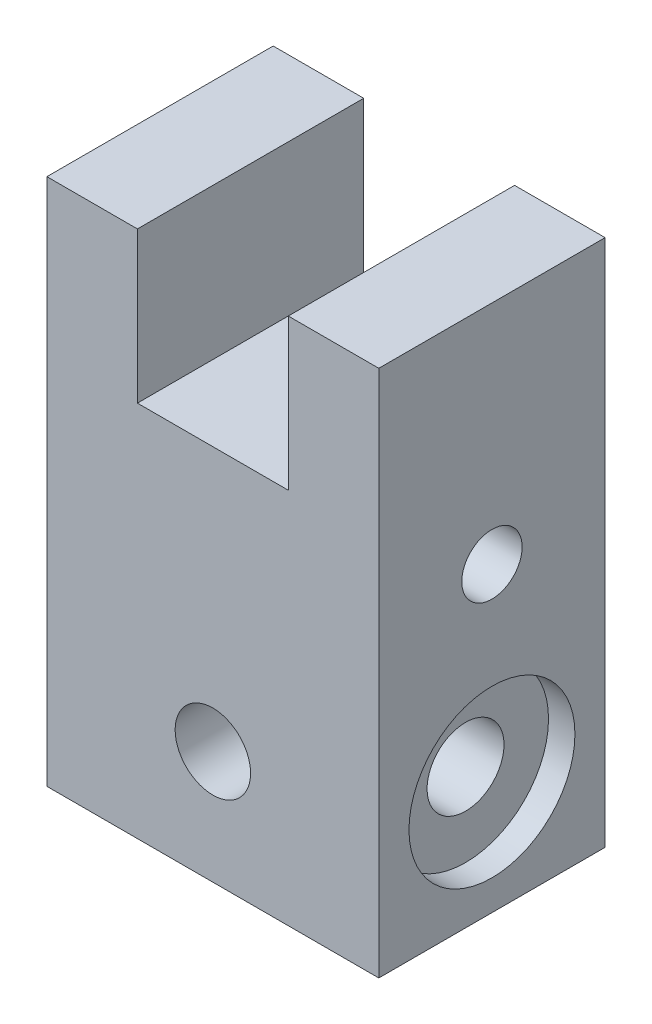
from build123d import *

# Parameters (mm, degrees)
CROQUIS1_R              = 5
SALIENTE_EXTRUIR1_DEPTH = 30
CROQUIS2_R              = 11
CORTAR_EXTRUIR1_DEPTH   = 3.5
CROQUIS3_R              = 5.1
CORTAR_EXTRUIR2_DEPTH   = 62.361632964
CROQUIS4_R              = 4
CORTAR_EXTRUIR3_DEPTH   = 64.725975982


with BuildPart() as part:
    # Croquis1 → Saliente-Extruir1 (new body)
    with BuildSketch(Plane.XY):
        Polygon((-10, 35), (-22, 35), (-22, -35), (22, -35), (22, 35), (10, 35), (10, 15), (-10, 15), align=None)
        with Locations((0, -20)):
            Circle(CROQUIS1_R, mode=Mode.SUBTRACT)
    extrude(amount=SALIENTE_EXTRUIR1_DEPTH)

    # Croquis2 → Cortar-Extruir1 (cut)
    with BuildSketch(Plane(origin=(22, 0, 0), x_dir=(0, 0, -1), z_dir=(1, 0, 0))):
        with Locations(Location((-15, -20, 0), (0, 0, 90))):
            Circle(CROQUIS2_R)
    extrude(amount=-CORTAR_EXTRUIR1_DEPTH, mode=Mode.SUBTRACT)

    # Croquis3 → Cortar-Extruir2 (cut, through all)
    with BuildSketch(Plane(origin=(18.5, 0, 0), x_dir=(0, 0, -1), z_dir=(1, 0, 0))):
        with Locations(Location((-15, -20, 0), (0, 0, 90))):
            Circle(CROQUIS3_R)
    extrude(amount=-CORTAR_EXTRUIR2_DEPTH, mode=Mode.SUBTRACT)

    # Croquis4 → Cortar-Extruir3 (cut, through all)
    with BuildSketch(Plane(origin=(22, 0, 0), x_dir=(0, 0, -1), z_dir=(1, 0, 0))):
        with Locations(Location((-15, 5, 0), (0, 0, 90))):
            Circle(CROQUIS4_R)
    extrude(amount=-CORTAR_EXTRUIR3_DEPTH, mode=Mode.SUBTRACT)


solid = part.part
